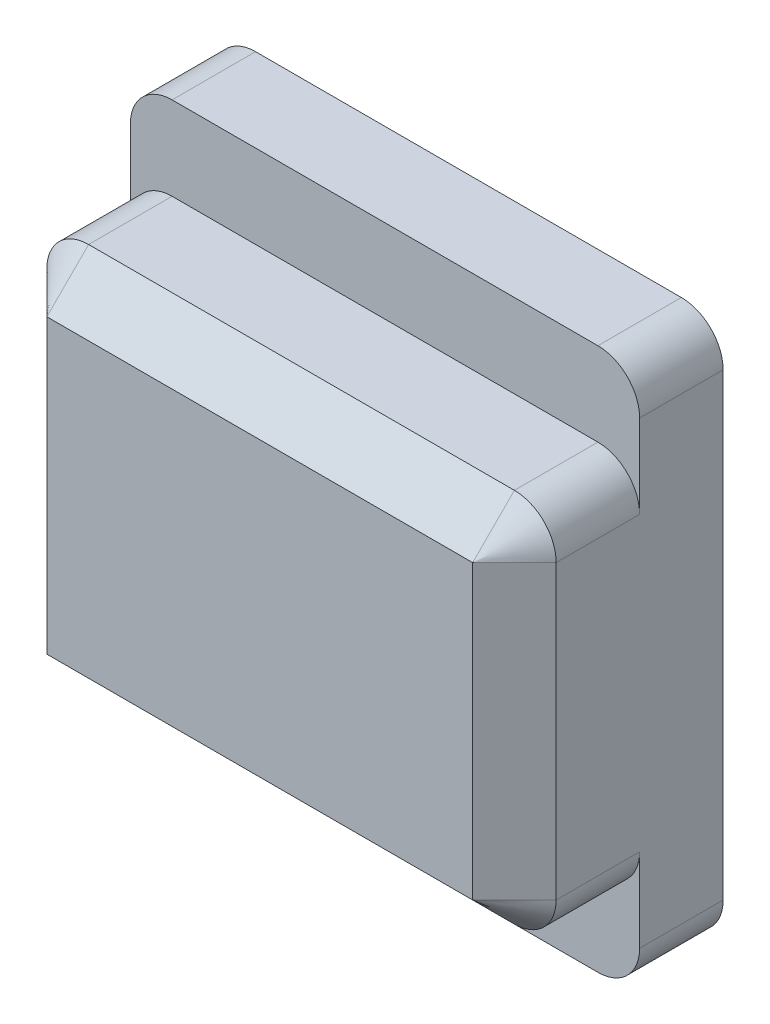
from build123d import *

# Parameters (mm, degrees)
EXTRUDE_1_DEPTH     = 2.5
SKETCH_2_W          = 15.8
SKETCH_2_H          = 6.5
EXTRUDE_2_DEPTH     = 1
FILLET_1_R          = 0.5
CUT_EXTRUDE_1_DEPTH = 12.419391402
SKETCH_4_W          = 21.55935693
SKETCH_4_H          = 12.890776674
SKETCH_4_W_2        = 6.1
SKETCH_4_H_2        = 6.5
CUT_EXTRUDE_2_DEPTH = 10
FILLET_2_R          = 0.5
CHAMFER_1_SIZE      = 0.5


with BuildPart() as part:
    # 草图1 → 凸台-拉伸1 (new body)
    with BuildSketch(Plane.XY):
        with BuildLine():
            Line((-9.05, -1.25), (-9.05, -3.45))
            ThreePointArc((-9.05, -3.45), (-8.713172798, -4.263172798), (-7.9, -4.6))
            Line((-7.9, -4.6), (7.9, -4.6))
            ThreePointArc((7.9, -4.6), (8.713172798, -4.263172798), (9.05, -3.45))
            Line((9.05, -3.45), (9.05, -1.25))
            ThreePointArc((9.05, -1.25), (8.713172798, -0.436827202), (7.9, -0.1))
            Line((7.9, -0.1), (-7.9, -0.1))
            ThreePointArc((-7.9, -0.1), (-8.713172798, -0.436827202), (-9.05, -1.25))
        make_face()
    extrude(amount=-EXTRUDE_1_DEPTH)

    # 草图2 → 凸台-拉伸2 (add)
    with BuildSketch(Plane(origin=(0, 0, -2.5), x_dir=(-1, 0, 0), z_dir=(0, 0, -1))):
        with Locations((0, -2.35)):
            Rectangle(SKETCH_2_W, SKETCH_2_H)
    extrude(amount=-EXTRUDE_2_DEPTH)

    # 圆角1
    fillet_1_edges = [part.edges().sort_by_distance(p)[0] for p in [
        (-7.9, 0.9, -2),
        (-7.9, -5.6, -2),
        (7.9, -5.6, -2),
        (7.9, 0.9, -2),
    ]]
    fillet(fillet_1_edges, radius=FILLET_1_R)

    # 草图3 → 切除-拉伸1 (cut, through all)
    with BuildSketch(Plane(origin=(0, 0.9, 0), x_dir=(1, 0, 0), z_dir=(0, 1, 0))):
        Polygon((8.475, 2.5), (9.05, 1.925), (9.05, 2.5), align=None)
        Polygon((-9.05, 1.925), (-9.05, 2.5), (-8.475, 2.5), align=None)
    extrude(amount=-CUT_EXTRUDE_1_DEPTH, mode=Mode.SUBTRACT)

    # 草图4 → 切除-拉伸2 (cut)
    with BuildSketch(Plane(origin=(0, 0, -2.5), x_dir=(-1, 0, 0), z_dir=(0, 0, -1))):
        with Locations((0, -2.35)):
            Rectangle(SKETCH_4_W, SKETCH_4_H)
        with Locations((0, -2.35)):
            Rectangle(SKETCH_4_W_2, SKETCH_4_H_2, mode=Mode.SUBTRACT)
    extrude(amount=-CUT_EXTRUDE_2_DEPTH, mode=Mode.SUBTRACT)

    # 圆角2
    fillet_2_edges = [part.edges().sort_by_distance(p)[0] for p in [
        (3.05, 0.9, -2),
        (-3.05, 0.9, -2),
        (3.05, -5.6, -2),
        (-3.05, -5.6, -2),
        (-3.05, -0.1, -0.75),
        (-3.05, -4.6, -0.75),
        (3.05, -0.1, -0.75),
        (3.05, -4.6, -0.75),
    ]]
    fillet(fillet_2_edges, radius=FILLET_2_R)

    # 倒角1
    chamfer_1_edges = [part.edges().sort_by_distance(p)[0] for p in [
        (0, -4.6, 0),
        (-3.05, -2.35, 0),
        (0, -0.1, 0),
        (3.05, -2.35, 0),
        (2.903553391, -0.246446609, 0),
        (-2.903553391, -0.246446609, 0),
        (2.903553391, -4.453553391, 0),
        (-2.903553391, -4.453553391, 0),
    ]]
    chamfer(chamfer_1_edges, length=CHAMFER_1_SIZE)


solid = part.part
